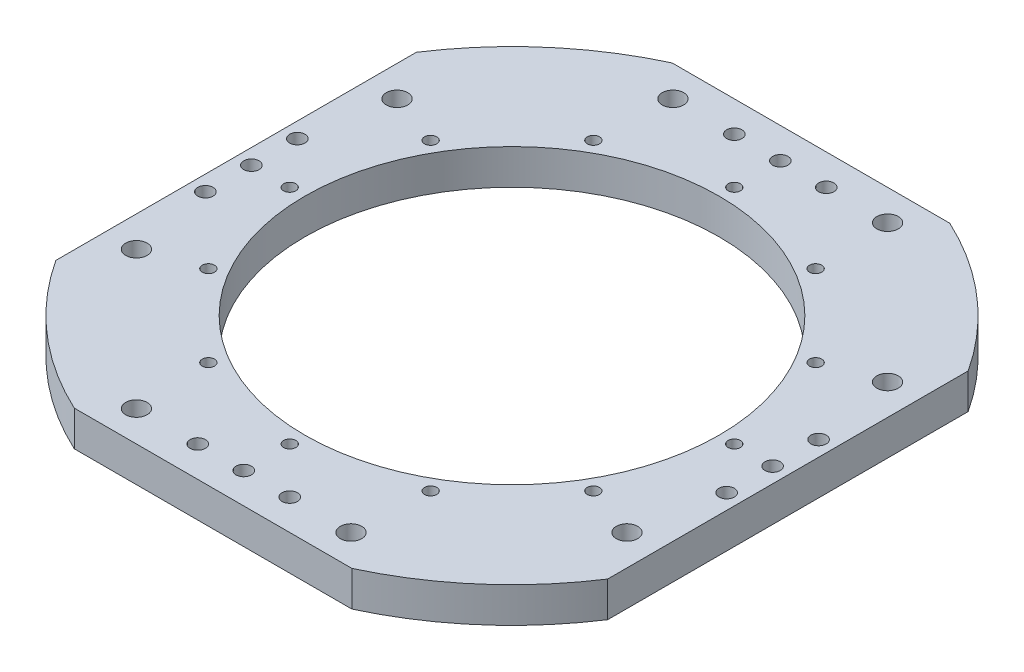
from build123d import *

# Parameters (mm, degrees)
SKETCH_1_R          = 135.1
SKETCH_1_R_2        = 4
EXTRUDE_1_DEPTH     = 11.5
SKETCH_2_R          = 5
SKETCH_2_R_2        = 7
CUT_EXTRUDE_1_DEPTH = 23


with BuildPart() as part:
    # 草图1 → 凸台-拉伸1 (new, symmetric)
    with BuildSketch(Plane(origin=(0, 0, 0), x_dir=(1, 0, 0), z_dir=(0, 1, 0))):
        with BuildLine():
            Line((-180, 117.579760163), (-180, -117.579760163))
            ThreePointArc((-180, -117.579760163), (-140.706503078, -162.562849359), (-90.553851381, -195))
            Line((-90.553851381, -195), (90.553851381, -195))
            ThreePointArc((90.553851381, -195), (140.706503078, -162.562849359), (180, -117.579760163))
            Line((180, -117.579760163), (180, 117.579760163))
            ThreePointArc((180, 117.579760163), (140.706503078, 162.562849359), (90.553851381, 195))
            Line((90.553851381, 195), (-90.553851381, 195))
            ThreePointArc((-90.553851381, 195), (-140.706503078, 162.562849359), (-180, 117.579760163))
        make_face()
        with Locations(Location((0, 0, 0), (0, 0, 270))):
            Circle(SKETCH_1_R, mode=Mode.SUBTRACT)
        with Locations(Location((0, 145, 0), (0, 0, 270))):
            Circle(SKETCH_1_R_2, mode=Mode.SUBTRACT)
        with Locations(Location((72.5, 125.573683549, 0), (0, 0, 270))):
            Circle(SKETCH_1_R_2, mode=Mode.SUBTRACT)
        with Locations(Location((125.573683549, 72.5, 0), (0, 0, 270))):
            Circle(SKETCH_1_R_2, mode=Mode.SUBTRACT)
        with Locations(Location((145, 0, 0), (0, 0, 270))):
            Circle(SKETCH_1_R_2, mode=Mode.SUBTRACT)
        with Locations(Location((125.573683549, -72.5, 0), (0, 0, 270))):
            Circle(SKETCH_1_R_2, mode=Mode.SUBTRACT)
        with Locations(Location((72.5, -125.573683549, 0), (0, 0, 270))):
            Circle(SKETCH_1_R_2, mode=Mode.SUBTRACT)
        with Locations(Location((0, -145, 0), (0, 0, 270))):
            Circle(SKETCH_1_R_2, mode=Mode.SUBTRACT)
        with Locations(Location((-72.5, -125.573683549, 0), (0, 0, 270))):
            Circle(SKETCH_1_R_2, mode=Mode.SUBTRACT)
        with Locations(Location((-125.573683549, -72.5, 0), (0, 0, 270))):
            Circle(SKETCH_1_R_2, mode=Mode.SUBTRACT)
        with Locations(Location((-145, 0, 0), (0, 0, 270))):
            Circle(SKETCH_1_R_2, mode=Mode.SUBTRACT)
        with Locations(Location((-125.573683549, 72.5, 0), (0, 0, 270))):
            Circle(SKETCH_1_R_2, mode=Mode.SUBTRACT)
        with Locations(Location((-72.5, 125.573683549, 0), (0, 0, 270))):
            Circle(SKETCH_1_R_2, mode=Mode.SUBTRACT)
    extrude(amount=EXTRUDE_1_DEPTH, both=True)

    # 草图2 → 切除-拉伸1 (cut)
    with BuildSketch(Plane(origin=(0, 11.5, 0), x_dir=(1, 0, 0), z_dir=(0, 1, 0))):
        with Locations(Location((0, 175, 0), (0, 0, 270))):
            Circle(SKETCH_2_R)
        with Locations(Location((-30, 175, 0), (0, 0, 270))):
            Circle(SKETCH_2_R)
        with Locations(Location((-70, 175, 0), (0, 0, 270))):
            Circle(SKETCH_2_R_2)
        with Locations(Location((70, 175, 0), (0, 0, 90))):
            Circle(SKETCH_2_R_2)
        with Locations(Location((30, 175, 0), (0, 0, 90))):
            Circle(SKETCH_2_R)
        with Locations(Location((-70, -175, 0), (0, 0, 90))):
            Circle(SKETCH_2_R_2)
        with Locations(Location((-30, -175, 0), (0, 0, 90))):
            Circle(SKETCH_2_R)
        with Locations(Location((0, -175, 0), (0, 0, 90))):
            Circle(SKETCH_2_R)
        with Locations(Location((30, -175, 0), (0, 0, 270))):
            Circle(SKETCH_2_R)
        with Locations(Location((70, -175, 0), (0, 0, 270))):
            Circle(SKETCH_2_R_2)
        with Locations(Location((160, 85, 0), (0, 0, 270))):
            Circle(SKETCH_2_R_2)
        with Locations(Location((170, 30, 0), (0, 0, 270))):
            Circle(SKETCH_2_R)
        with Locations(Location((170, 0, 0), (0, 0, 270))):
            Circle(SKETCH_2_R)
        with Locations(Location((160, -85, 0), (0, 0, 90))):
            Circle(SKETCH_2_R_2)
        with Locations(Location((170, -30, 0), (0, 0, 90))):
            Circle(SKETCH_2_R)
        with Locations(Location((-170, -30, 0), (0, 0, 270))):
            Circle(SKETCH_2_R)
        with Locations(Location((-160, -85, 0), (0, 0, 270))):
            Circle(SKETCH_2_R_2)
        with Locations(Location((-170, 0, 0), (0, 0, 90))):
            Circle(SKETCH_2_R)
        with Locations(Location((-170, 30, 0), (0, 0, 90))):
            Circle(SKETCH_2_R)
        with Locations(Location((-160, 85, 0), (0, 0, 90))):
            Circle(SKETCH_2_R_2)
    extrude(amount=-CUT_EXTRUDE_1_DEPTH, mode=Mode.SUBTRACT)


solid = part.part
